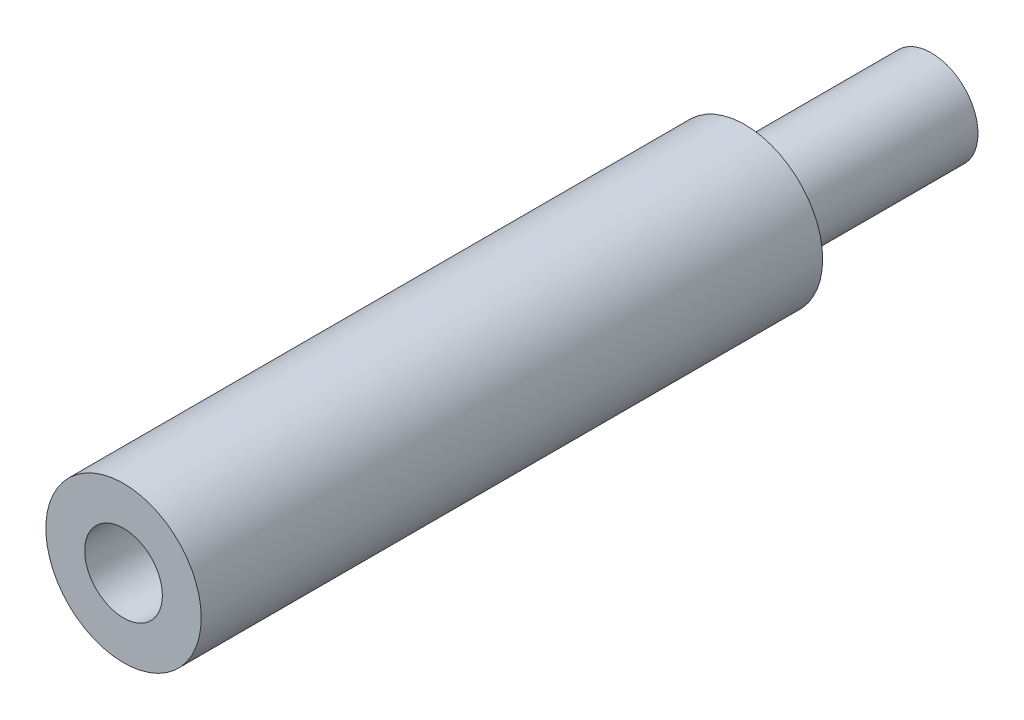
from build123d import *

# Parameters (mm, degrees)
SKETCH1_R           = 1.5
BOSS_EXTRUDE1_DEPTH = 6
SKETCH2_R           = 2.5
BOSS_EXTRUDE2_DEPTH = 20
SKETCH3_R           = 1.25
CUT_EXTRUDE1_DEPTH  = 6


with BuildPart() as part:
    # Sketch1 → Boss-Extrude1 (new body)
    with BuildSketch(Plane.XY):
        Circle(SKETCH1_R)
    extrude(amount=BOSS_EXTRUDE1_DEPTH)

    # Sketch2 → Boss-Extrude2 (add)
    with BuildSketch(Plane.XY.offset(6)):
        Circle(SKETCH2_R)
    extrude(amount=BOSS_EXTRUDE2_DEPTH)

    # Sketch3 → Cut-Extrude1 (cut)
    with BuildSketch(Plane.XY.offset(26)):
        Circle(SKETCH3_R)
    extrude(amount=-CUT_EXTRUDE1_DEPTH, mode=Mode.SUBTRACT)


solid = part.part
